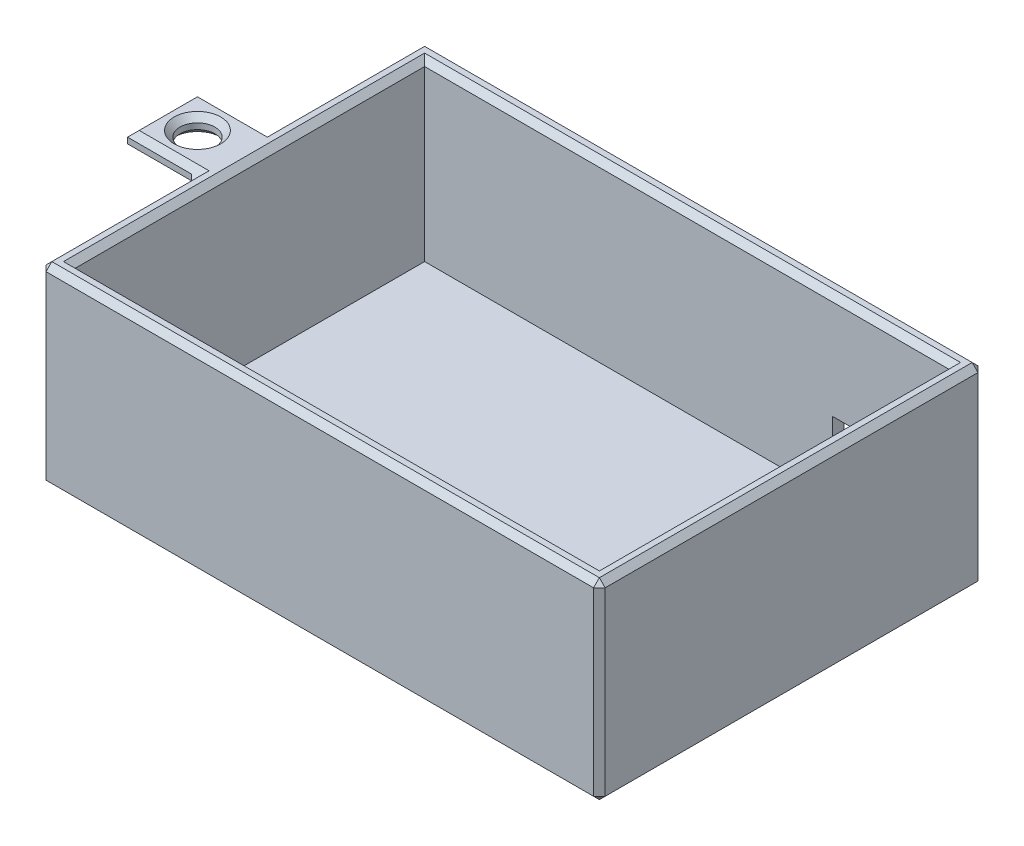
from build123d import *

# Parameters (mm, degrees)
SKETCH_1_W          = 80
SKETCH_1_H          = 50
EXTRUDE_1_DEPTH     = 3
SKETCH_2_W          = 90
SKETCH_2_H          = 60
SKETCH_2_W_2        = 80
SKETCH_2_H_2        = 50
EXTRUDE_3_DEPTH     = 3
SKETCH_2_3_W        = 96
SKETCH_2_3_H        = 66
SKETCH_2_3_W_2      = 90
SKETCH_2_3_H_2      = 60
EXTRUDE_4_DEPTH     = 33
SKETCH_3_W          = 20
SKETCH_3_H          = 12
CUT_EXTRUDE_1_DEPTH = 10
SKETCH_4_R          = 3
EXTRUDE_5_DEPTH     = 3
CHAMFER_1_SIZE      = 1
CHAMFER_2_SIZE      = 1


with BuildPart() as part:
    # 草图1 → 凸台-拉伸1 (new body)
    with BuildSketch(Plane(origin=(0, 0, 0), x_dir=(1, 0, 0), z_dir=(0, 1, 0))):
        with Locations((40, -25)):
            Rectangle(SKETCH_1_W, SKETCH_1_H)
    extrude(amount=EXTRUDE_1_DEPTH)

    # 草图2 → 凸台-拉伸3 (add)
    with BuildSketch(Plane.XZ):
        with Locations((40, 25)):
            Rectangle(SKETCH_2_W, SKETCH_2_H)
        with Locations((40, 25)):
            Rectangle(SKETCH_2_W_2, SKETCH_2_H_2, mode=Mode.SUBTRACT)
    extrude(amount=-EXTRUDE_3_DEPTH)

    # 草图2<3> → 凸台-拉伸4 (add)
    with BuildSketch(Plane.XZ):
        with Locations((40, 25)):
            Rectangle(SKETCH_2_3_W, SKETCH_2_3_H)
        with Locations((40, 25)):
            Rectangle(SKETCH_2_3_W_2, SKETCH_2_3_H_2, mode=Mode.SUBTRACT)
    extrude(amount=-EXTRUDE_4_DEPTH)

    # 草图3 → 切除-拉伸1 (cut)
    with BuildSketch(Plane(origin=(0, 0, -8), x_dir=(-1, 0, 0), z_dir=(0, 0, -1))):
        with Locations((-75, 9)):
            Rectangle(SKETCH_3_W, SKETCH_3_H)
    extrude(amount=-CUT_EXTRUDE_1_DEPTH, mode=Mode.SUBTRACT)

    # 草图4 → 凸台-拉伸5 (add)
    with BuildSketch(Plane(origin=(0, 33, 0), x_dir=(1, 0, 0), z_dir=(0, 1, 0))):
        Polygon((-8, -25), (-8, -19), (-20, -19), (-20, -25), (-20, -31), (-8, -31), align=None)
        with Locations(Location((-14, -25, 0), (0, 0, 270))):
            Circle(SKETCH_4_R, mode=Mode.SUBTRACT)
    extrude(amount=-EXTRUDE_5_DEPTH)

    # 倒角1
    chamfer_1_edges = [part.edges().sort_by_distance(p)[0] for p in [
        (88, 0, 25),
        (40, 0, 58),
        (-8, 0, 25),
        (40, 0, -8),
        (40, 33, 58),
        (-8, 16.5, 58),
        (-8, 33, 44.5),
        (-8, 16.5, -8),
        (40, 33, -8),
        (88, 16.5, -8),
        (88, 33, 25),
        (88, 16.5, 58),
        (85, 33, 25),
        (40, 33, 55),
        (-5, 33, 25),
        (40, 33, -5),
        (85, 9, -8),
        (75, 3, -8),
        (65, 9, -8),
        (75, 15, -8),
        (-8, 33, 5.5),
        (-14, 33, 31),
        (-14, 33, 19),
        (-20, 33, 25),
        (-14, 33, 22),
    ]]
    chamfer(chamfer_1_edges, length=CHAMFER_1_SIZE)

    # 倒角2
    chamfer_2_edges = [part.edges().sort_by_distance(p)[0] for p in [
        (-14, 30, 31),
        (-8, 31, 31),
        (-20, 30, 25),
        (-14, 30, 19),
        (-8, 30, 25),
        (-8, 31, 19),
        (-14, 30, 22),
    ]]
    chamfer(chamfer_2_edges, length=CHAMFER_2_SIZE)


solid = part.part
